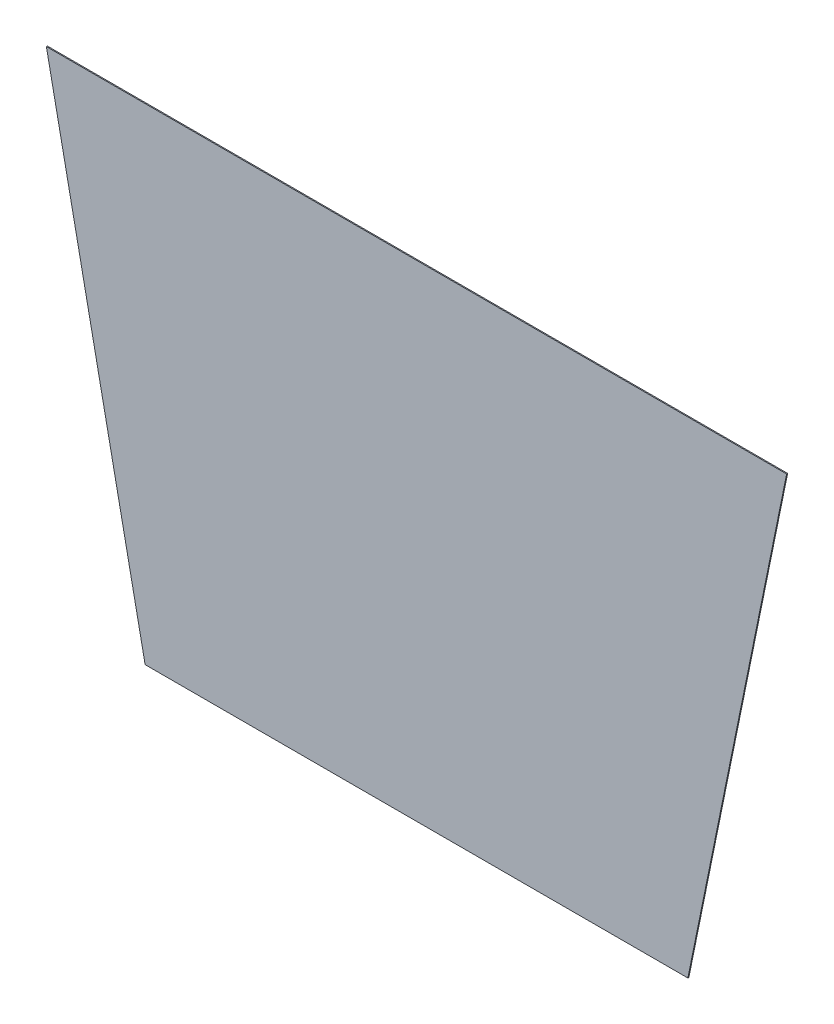
from build123d import *

# Parameters (mm, degrees)
BOSS_EXTRUDE1_DEPTH = 1.5


with BuildPart() as part:
    # Sketch1 → Boss-Extrude1 (new body)
    with BuildSketch(Plane.XY):
        Polygon((-371.257484536, -179.138226804), (438.742515464, -179.138226804), (586.148223134, 546.031792809), (-518.663192206, 546.031792809), align=None)
    extrude(amount=BOSS_EXTRUDE1_DEPTH)


solid = part.part
